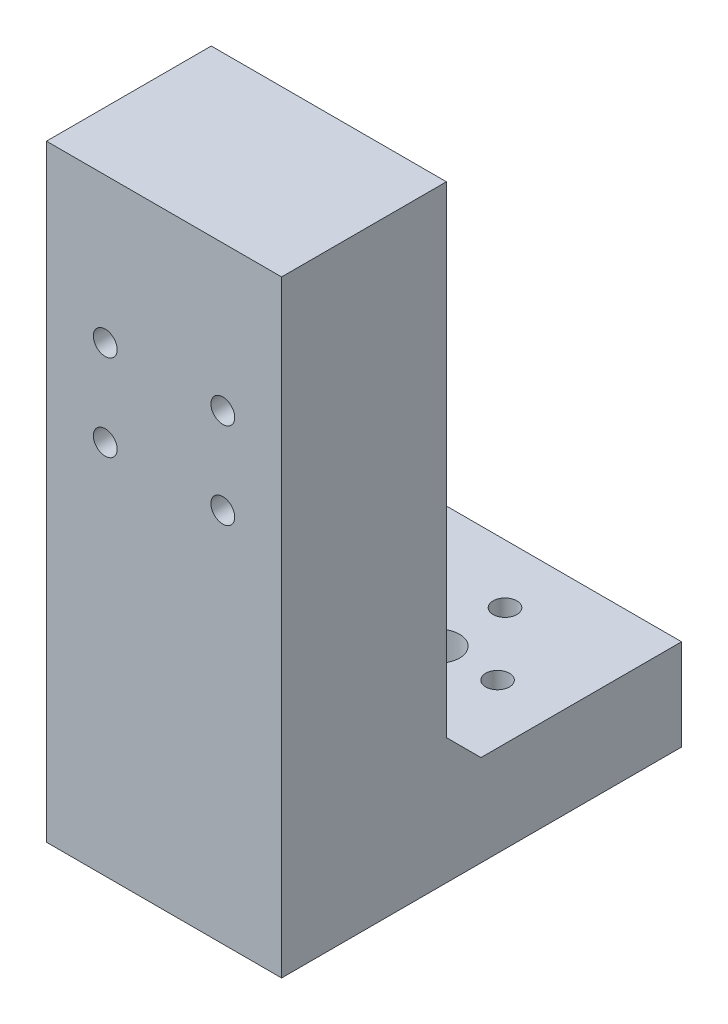
from build123d import *

# Parameters (mm, degrees)
SKETCH5_W           = 34
SKETCH5_H           = 34
BOSS_EXTRUDE1_DEPTH = 13.19
SKETCH6_W           = 34
SKETCH6_H           = 87.79
BOSS_EXTRUDE2_DEPTH = 23.83
SKETCH7_R           = 3
CUT_EXTRUDE1_DEPTH  = 21.83
SKETCH8_R           = 1.72
CUT_EXTRUDE2_DEPTH  = 31.83
SKETCH9_R           = 1.72
CUT_EXTRUDE3_DEPTH  = 31.83
RIB18_REACH         = 103.535
SKETCH20_WALL_W     = 212.140430626
SKETCH20_WALL_H     = 2
RIB19_REACH         = 103.535
SKETCH21_WALL_W     = 212.140430626
SKETCH21_WALL_H     = 2


with BuildPart() as part:
    # Sketch5 → Boss-Extrude1 (new body)
    with BuildSketch(Plane(origin=(0, 0, 0), x_dir=(1, 0, 0), z_dir=(0, 1, 0))):
        with Locations((14.397550388, 1.103341085)):
            Rectangle(SKETCH5_W, SKETCH5_H)
    extrude(amount=BOSS_EXTRUDE1_DEPTH)

    # Sketch6 → Boss-Extrude2 (add)
    with BuildSketch(Plane.XY.offset(15.896658915)):
        with Locations((14.397550388, 43.895)):
            Rectangle(SKETCH6_W, SKETCH6_H)
    extrude(amount=BOSS_EXTRUDE2_DEPTH)

    # Sketch7 → Cut-Extrude1 (cut)
    with BuildSketch(Plane(origin=(0, 13.19, 0), x_dir=(1, 0, 0), z_dir=(0, 1, 0))):
        with Locations(Location((14.397550388, 0, 0), (0, 0, 270))):
            Circle(SKETCH7_R)
    extrude(amount=-CUT_EXTRUDE1_DEPTH, mode=Mode.SUBTRACT)

    # Sketch8 → Cut-Extrude2 (cut)
    with BuildSketch(Plane.XY.offset(39.726658915)):
        with Locations((5.897550388, 66.793195428)):
            Circle(SKETCH8_R)
        with Locations((22.897550388, 66.793195428)):
            Circle(SKETCH8_R)
        with Locations((5.897550388, 54.310639336)):
            Circle(SKETCH8_R)
        with Locations((22.897550388, 54.310639336)):
            Circle(SKETCH8_R)
    extrude(amount=-CUT_EXTRUDE2_DEPTH, mode=Mode.SUBTRACT)

    # Sketch9 → Cut-Extrude3 (cut)
    with BuildSketch(Plane(origin=(0, 13.19, 0), x_dir=(1, 0, 0), z_dir=(0, 1, 0))):
        with Locations(Location((22.897550388, 0, 0), (0, 0, 270))):
            Circle(SKETCH9_R)
        with Locations(Location((14.369066497, 9.603341085, 0), (0, 0, 270))):
            Circle(SKETCH9_R)
        with Locations(Location((14.369066497, -7.396658915, 0), (0, 0, 270))):
            Circle(SKETCH9_R)
        with Locations(Location((5.897550388, 0, 0), (0, 0, 270))):
            Circle(SKETCH9_R)
    extrude(amount=-CUT_EXTRUDE3_DEPTH, mode=Mode.SUBTRACT)

    # Sketch20 wall → Rib18 (add, up to next)
    with BuildSketch(Plane(origin=(-0.602449612, 15.69, 13.396658915), x_dir=(0, 0.707106781187, 0.707106781187), z_dir=(0, 0.707106781187, -0.707106781187)), mode=Mode.PRIVATE) as rib18_sk1:
        with Locations((0, -1)):
            Rectangle(SKETCH20_WALL_W, SKETCH20_WALL_H)
    rib18_tool1 = extrude(rib18_sk1.sketch, amount=-RIB18_REACH, mode=Mode.PRIVATE) - part.part
    add(rib18_tool1.solids().sort_by_distance((-0.602449612, 15.69, 13.396658915))[0])

    # Sketch21 wall → Rib19 (add, up to next)
    with BuildSketch(Plane(origin=(29.397550388, 15.69, 13.396658915), x_dir=(0, -0.707106781187, -0.707106781187), z_dir=(0, 0.707106781187, -0.707106781187)), mode=Mode.PRIVATE) as rib19_sk1:
        with Locations((0, -1)):
            Rectangle(SKETCH21_WALL_W, SKETCH21_WALL_H)
    rib19_tool1 = extrude(rib19_sk1.sketch, amount=-RIB19_REACH, mode=Mode.PRIVATE) - part.part
    add(rib19_tool1.solids().sort_by_distance((29.397550388, 15.69, 13.396658915))[0])


solid = part.part
